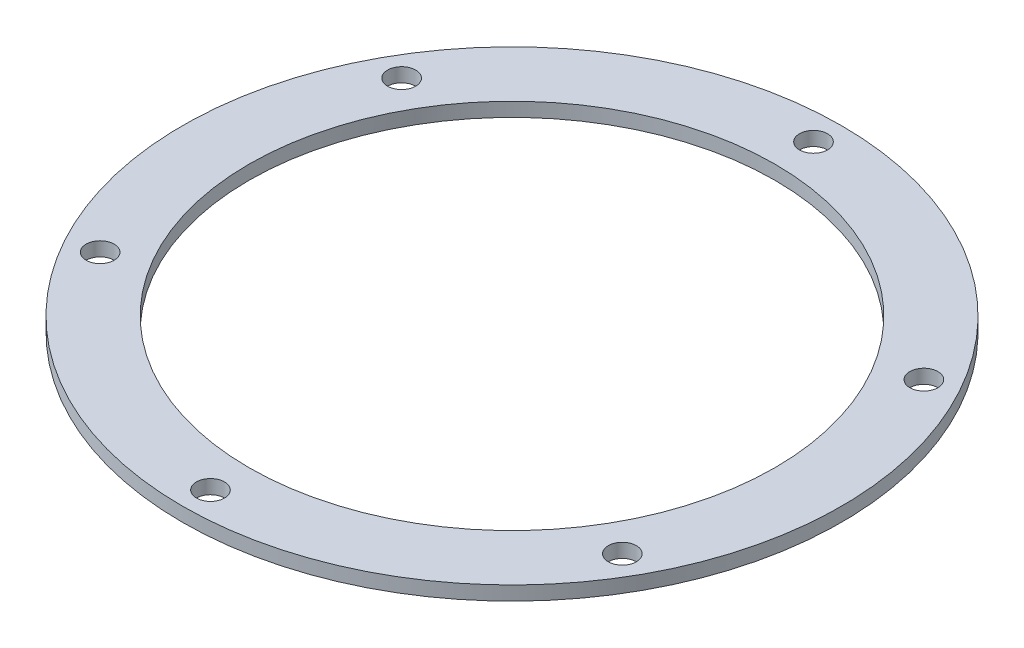
from build123d import *

# Parameters (mm, degrees)
SKETCH1_R           = 47
SKETCH1_R_2         = 37.5
SKETCH1_R_3         = 2
BOSS_EXTRUDE1_DEPTH = 2


with BuildPart() as part:
    # Sketch1 → Boss-Extrude1 (new body)
    with BuildSketch(Plane(origin=(0, 0, 0), x_dir=(1, 0, 0), z_dir=(0, 1, 0))):
        with Locations(Location((0, 0, 0), (0, 0, 270))):
            Circle(SKETCH1_R)
        with Locations(Location((0, 0, 0), (0, 0, 270))):
            Circle(SKETCH1_R_2, mode=Mode.SUBTRACT)
        with Locations(Location((0, 43, 0), (0, 0, 270))):
            Circle(SKETCH1_R_3, mode=Mode.SUBTRACT)
        with Locations(Location((37.239092363, 21.5, 0), (0, 0, 270))):
            Circle(SKETCH1_R_3, mode=Mode.SUBTRACT)
        with Locations(Location((37.239092363, -21.5, 0), (0, 0, 270))):
            Circle(SKETCH1_R_3, mode=Mode.SUBTRACT)
        with Locations(Location((0, -43, 0), (0, 0, 270))):
            Circle(SKETCH1_R_3, mode=Mode.SUBTRACT)
        with Locations(Location((-37.239092363, -21.5, 0), (0, 0, 270))):
            Circle(SKETCH1_R_3, mode=Mode.SUBTRACT)
        with Locations(Location((-37.239092363, 21.5, 0), (0, 0, 270))):
            Circle(SKETCH1_R_3, mode=Mode.SUBTRACT)
    extrude(amount=BOSS_EXTRUDE1_DEPTH)


solid = part.part
